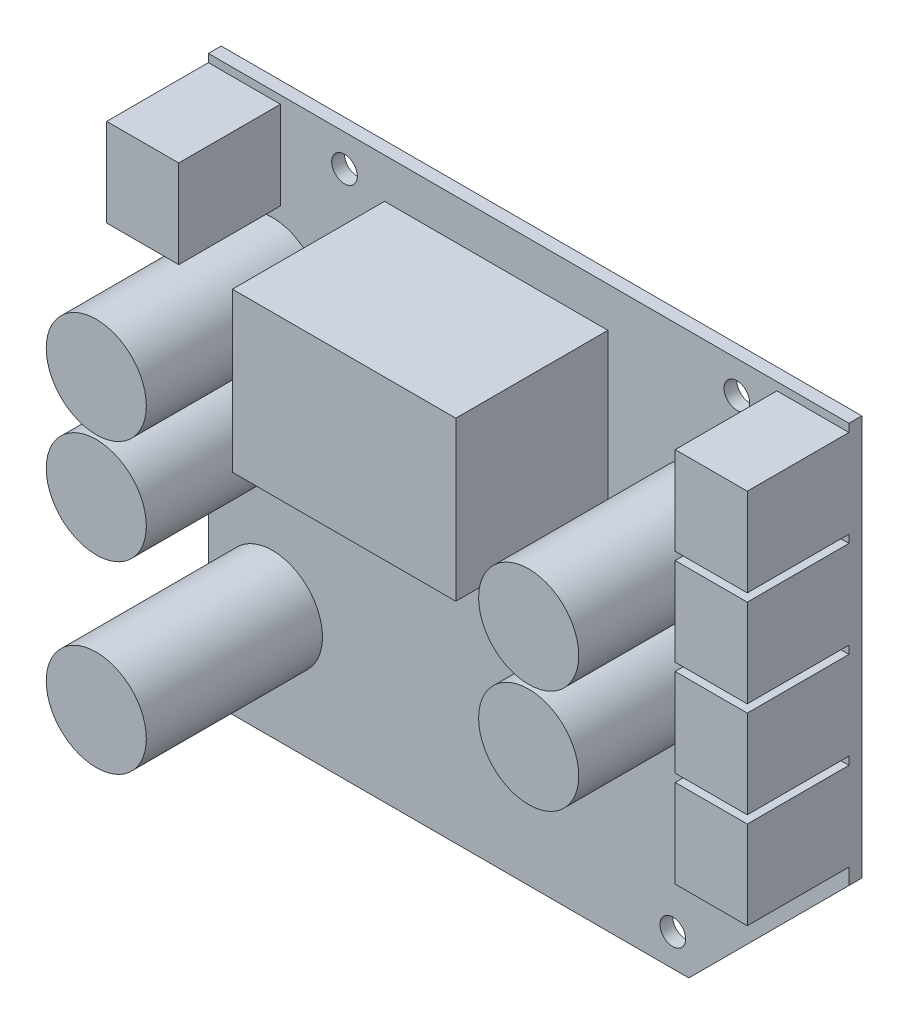
from build123d import *

# Parameters (mm, degrees)
ESQUISSE1_R        = 1.6
BOSS_EXTRU_1_DEPTH = 1.6
ESQUISSE2_W        = 9
ESQUISSE2_H        = 11
BOSS_EXTRU_2_DEPTH = 12.7
ESQUISSE3_R        = 6.25
BOSS_EXTRU_3_DEPTH = 22
ESQUISSE4_W        = 27.9
ESQUISSE4_H        = 19.8
BOSS_EXTRU_4_DEPTH = 19


with BuildPart() as part:
    # Esquisse1 → Boss.-Extru.1 (new body)
    with BuildSketch(Plane.XY):
        Polygon((0, 0), (80, 0), (80, -50), (60, -70), (0, -70), align=None)
        with Locations((17, -4)):
            Circle(ESQUISSE1_R, mode=Mode.SUBTRACT)
        with Locations((66, -4)):
            Circle(ESQUISSE1_R, mode=Mode.SUBTRACT)
        with Locations((58, -66)):
            Circle(ESQUISSE1_R, mode=Mode.SUBTRACT)
        with Locations((4, -66)):
            Circle(ESQUISSE1_R, mode=Mode.SUBTRACT)
    extrude(amount=BOSS_EXTRU_1_DEPTH)

    # Esquisse2 → Boss.-Extru.2 (add)
    with BuildSketch(Plane.XY.offset(1.6)):
        with Locations((4.5, -6.5)):
            Rectangle(ESQUISSE2_W, ESQUISSE2_H)
        with Locations((75.5, -6.5)):
            Rectangle(ESQUISSE2_W, ESQUISSE2_H)
        with Locations((75.5, -18.5)):
            Rectangle(ESQUISSE2_W, ESQUISSE2_H)
        with Locations((75.5, -30.5)):
            Rectangle(ESQUISSE2_W, ESQUISSE2_H)
        with Locations((75.5, -42.5)):
            Rectangle(ESQUISSE2_W, ESQUISSE2_H)
    extrude(amount=BOSS_EXTRU_2_DEPTH)

    # Esquisse3 → Boss.-Extru.3 (add)
    with BuildSketch(Plane.XY.offset(1.6)):
        with Locations(Location((8, -20, 0), (0, 0, 180))):
            Circle(ESQUISSE3_R)
        with Locations(Location((8, -33, 0), (0, 0, 180))):
            Circle(ESQUISSE3_R)
        with Locations(Location((8, -56, 0), (0, 0, 180))):
            Circle(ESQUISSE3_R)
        with Locations(Location((62, -20, 0), (0, 0, 180))):
            Circle(ESQUISSE3_R)
        with Locations(Location((62, -33, 0), (0, 0, 180))):
            Circle(ESQUISSE3_R)
    extrude(amount=BOSS_EXTRU_3_DEPTH)

    # Esquisse4 → Boss.-Extru.4 (add)
    with BuildSketch(Plane.XY.offset(1.6)):
        with Locations((35.95, -14.9)):
            Rectangle(ESQUISSE4_W, ESQUISSE4_H)
    extrude(amount=BOSS_EXTRU_4_DEPTH)


solid = part.part
